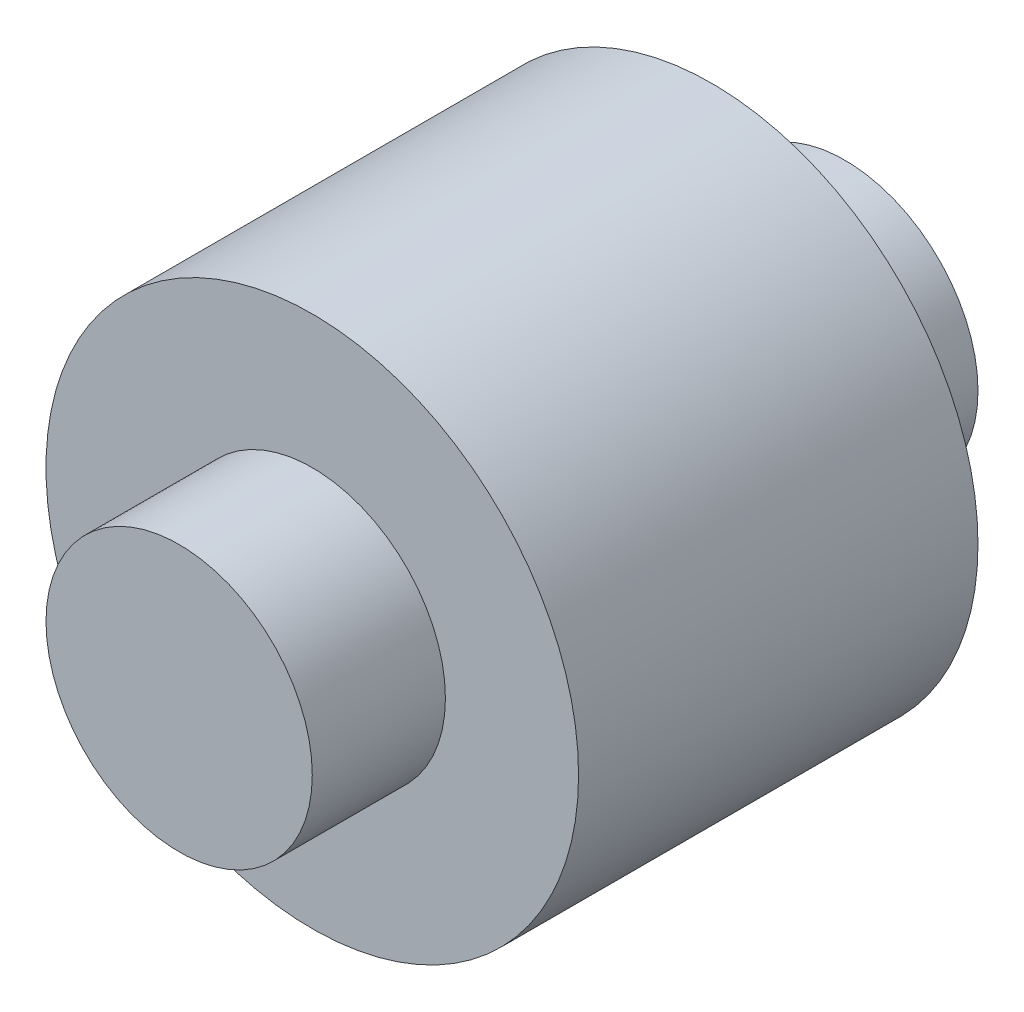
from build123d import *

# Parameters (mm, degrees)
SKETCH_1_R      = 10
EXTRUDE_1_DEPTH = 15
SKETCH_2_R      = 5
EXTRUDE_2_DEPTH = 5


with BuildPart() as part:
    # 스케치1 → 보스-돌출1 (new body)
    with BuildSketch(Plane.XY):
        Circle(SKETCH_1_R)
    extrude(amount=EXTRUDE_1_DEPTH)

    # 스케치2 → 보스-돌출2 (add)
    with BuildSketch(Plane.XY.offset(15)):
        Circle(SKETCH_2_R)
    extrude_2 = extrude(amount=EXTRUDE_2_DEPTH)

    # 대칭 복사1: 보스-돌출2 across plane
    add(extrude_2.mirror(Plane(origin=(0, 0, 7.5), x_dir=(1, 0, 0), z_dir=(0, 0, -1))))


solid = part.part
